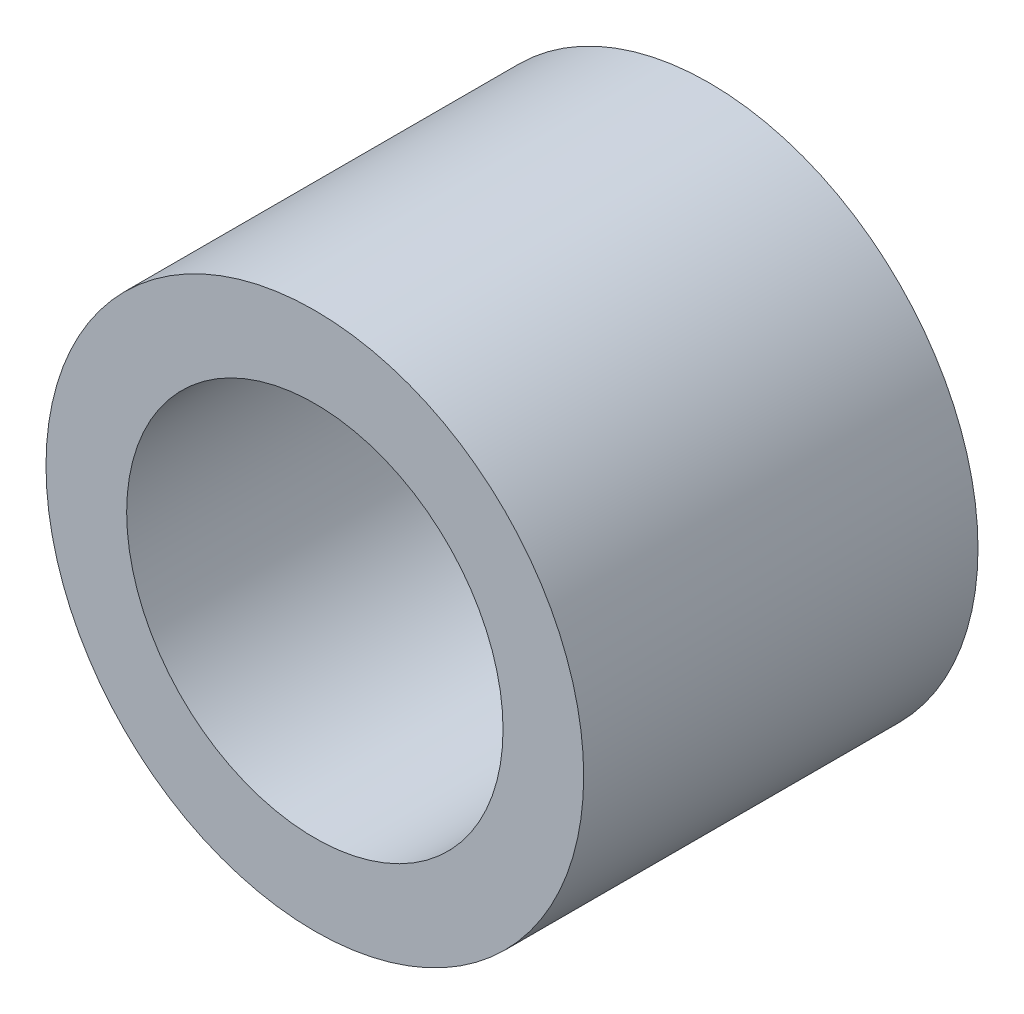
from build123d import *

# Parameters (mm, degrees)
CROQUIS1_R                 = 15
SALIENTE_EXTRUIR1_DEPTH    = 22
CROQUIS2_R                 = 10.5
CORTAR_EXTRUIR1_DEPTH      = 16
CORTAR_EXTRUIR2_START      = -1
CORTAR_EXTRUIR2_DEPTH      = 1
CORTAR_EXTRUIR3_START      = -1
CROQUIS5_R                 = 11
CROQUIS5_R_2               = 10.5
CORTAR_EXTRUIR3_DEPTH      = 1
CORTAR_EXTRUIR4_DEPTH      = 31.56141358
CORTAR_EXTRUIR4_DEPTH_BACK = 31.56141358
CROQUIS6_R                 = 1.25


with BuildPart() as part:
    # Croquis1 → Saliente-Extruir1 (new body)
    with BuildSketch(Plane.XY):
        Circle(CROQUIS1_R)
    extrude(amount=SALIENTE_EXTRUIR1_DEPTH)

    # Croquis2 → Cortar-Extruir1 (cut)
    with BuildSketch(Plane.XY.offset(22)):
        Circle(CROQUIS2_R)
    extrude(amount=-CORTAR_EXTRUIR1_DEPTH, mode=Mode.SUBTRACT)

    # Croquis3 → Cortar-Extruir2 (cut)
    with BuildSketch(Plane(origin=(0, 0, 0), x_dir=(-1, 0, 0), z_dir=(0, 0, -1)).offset(CORTAR_EXTRUIR2_START)):
        with BuildLine():
            ThreePointArc((1.25, 10.425329731), (0, 10.5), (-1.25, 10.425329731))
            Line((-1.25, 10.425329731), (-1.25, 9.5))
            Line((-1.25, 9.5), (1.25, 9.5))
            Line((1.25, 9.5), (1.25, 10.425329731))
        make_face()
        with BuildLine():
            Line((-7.602241336, 5.832531755), (-8.40360039, 6.29519662))
            ThreePointArc((-8.40360039, 6.29519662), (-9.09326674, 5.25), (-9.65360039, 4.130133111))
            Line((-9.65360039, 4.130133111), (-8.852241336, 3.667468245))
            Line((-8.852241336, 3.667468245), (-7.602241336, 5.832531755))
        make_face()
        with BuildLine():
            ThreePointArc((9.65360039, 4.130133111), (9.09326674, 5.25), (8.40360039, 6.29519662))
            Line((8.40360039, 6.29519662), (7.602241336, 5.832531755))
            Line((7.602241336, 5.832531755), (8.852241336, 3.667468245))
            Line((8.852241336, 3.667468245), (9.65360039, 4.130133111))
        make_face()
        with BuildLine():
            Line((-8.852241336, -3.667468245), (-9.65360039, -4.130133111))
            ThreePointArc((-9.65360039, -4.130133111), (-9.09326674, -5.25), (-8.40360039, -6.29519662))
            Line((-8.40360039, -6.29519662), (-7.602241336, -5.832531755))
            Line((-7.602241336, -5.832531755), (-8.852241336, -3.667468245))
        make_face()
        with BuildLine():
            ThreePointArc((8.40360039, -6.29519662), (9.09326674, -5.25), (9.65360039, -4.130133111))
            Line((9.65360039, -4.130133111), (8.852241336, -3.667468245))
            Line((8.852241336, -3.667468245), (7.602241336, -5.832531755))
            Line((7.602241336, -5.832531755), (8.40360039, -6.29519662))
        make_face()
        with BuildLine():
            Line((-1.25, -9.5), (-1.25, -10.425329731))
            ThreePointArc((-1.25, -10.425329731), (0, -10.5), (1.25, -10.425329731))
            Line((1.25, -10.425329731), (1.25, -9.5))
            Line((1.25, -9.5), (-1.25, -9.5))
        make_face()
    extrude(amount=CORTAR_EXTRUIR2_DEPTH, mode=Mode.SUBTRACT)

    # Croquis5 → Cortar-Extruir3 (cut)
    with BuildSketch(Plane(origin=(0, 0, 0), x_dir=(-1, 0, 0), z_dir=(0, 0, -1)).offset(CORTAR_EXTRUIR3_START)):
        Circle(CROQUIS5_R)
        Circle(CROQUIS5_R_2, mode=Mode.SUBTRACT)
    extrude(amount=CORTAR_EXTRUIR3_DEPTH, mode=Mode.SUBTRACT)

    # Croquis6 → Cortar-Extruir4 (cut, two sides: drawn at the far end of the back side and taken through both)
    with BuildSketch(Plane(origin=(0, 0, 0), x_dir=(-1, 0, 0), z_dir=(0, 0, -1)).offset(-CORTAR_EXTRUIR4_DEPTH_BACK)):
        Circle(CROQUIS6_R)
    extrude(amount=CORTAR_EXTRUIR4_DEPTH + CORTAR_EXTRUIR4_DEPTH_BACK, mode=Mode.SUBTRACT)


solid = part.part
